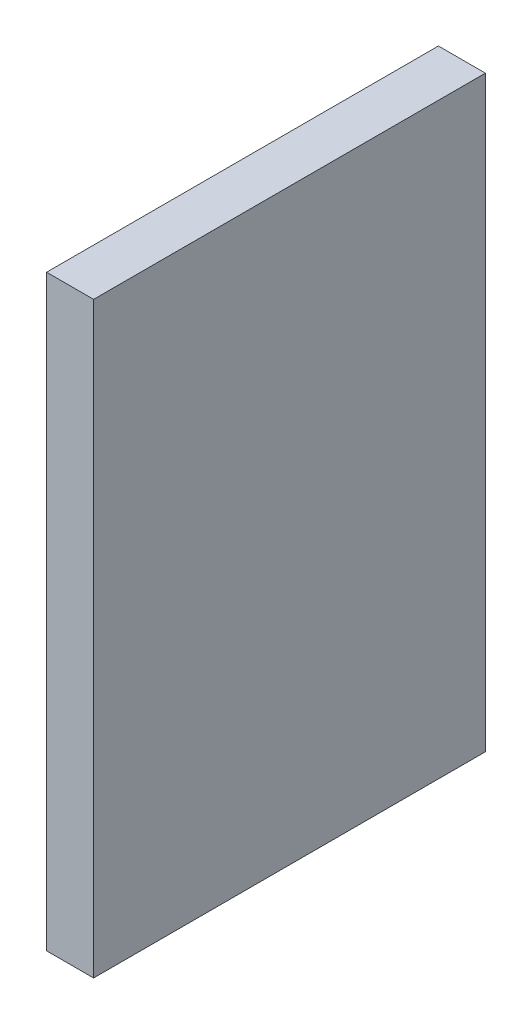
from build123d import *

# Parameters (mm, degrees)
SKETCH1_W           = 150
SKETCH1_H           = 100
BOSS_EXTRUDE1_DEPTH = 12


with BuildPart() as part:
    # Sketch1 → Boss-Extrude1 (new body)
    with BuildSketch(Plane.YZ):
        Rectangle(SKETCH1_W, SKETCH1_H)
    extrude(amount=BOSS_EXTRUDE1_DEPTH)


solid = part.part
